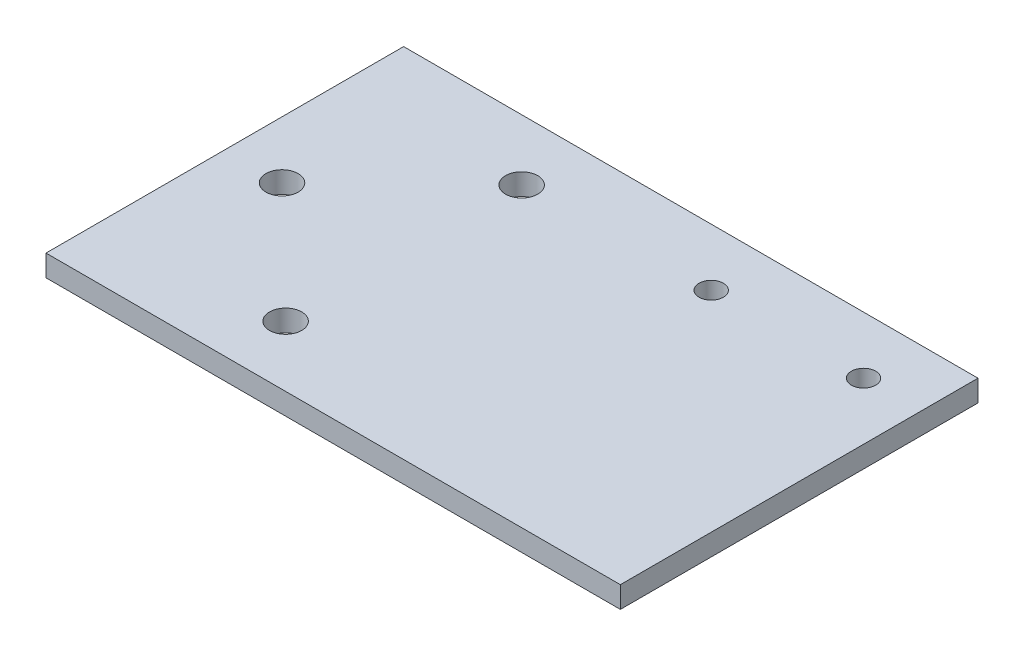
from build123d import *

# Parameters (mm, degrees)
SKETCH1_W           = 80.3
SKETCH1_H           = 50
SKETCH1_R           = 1.7
SKETCH1_R_2         = 2.25
BOSS_EXTRUDE1_DEPTH = 3


with BuildPart() as part:
    # Sketch1 → Boss-Extrude1 (new body)
    with BuildSketch(Plane(origin=(0, 0, 0), x_dir=(1, 0, 0), z_dir=(0, 1, 0))):
        with Locations((40.15, 25)):
            Rectangle(SKETCH1_W, SKETCH1_H)
        with Locations(Location((51, 42, 0), (0, 0, 270))):
            Circle(SKETCH1_R, mode=Mode.SUBTRACT)
        with Locations(Location((72.3, 42, 0), (0, 0, 270))):
            Circle(SKETCH1_R, mode=Mode.SUBTRACT)
        with Locations(Location((8, 25, 0), (0, 0, 270))):
            Circle(SKETCH1_R_2, mode=Mode.SUBTRACT)
        with Locations(Location((25, 8.5, 0), (0, 0, 270))):
            Circle(SKETCH1_R_2, mode=Mode.SUBTRACT)
        with Locations(Location((25, 41.5, 0), (0, 0, 270))):
            Circle(SKETCH1_R_2, mode=Mode.SUBTRACT)
    extrude(amount=BOSS_EXTRUDE1_DEPTH)


solid = part.part
